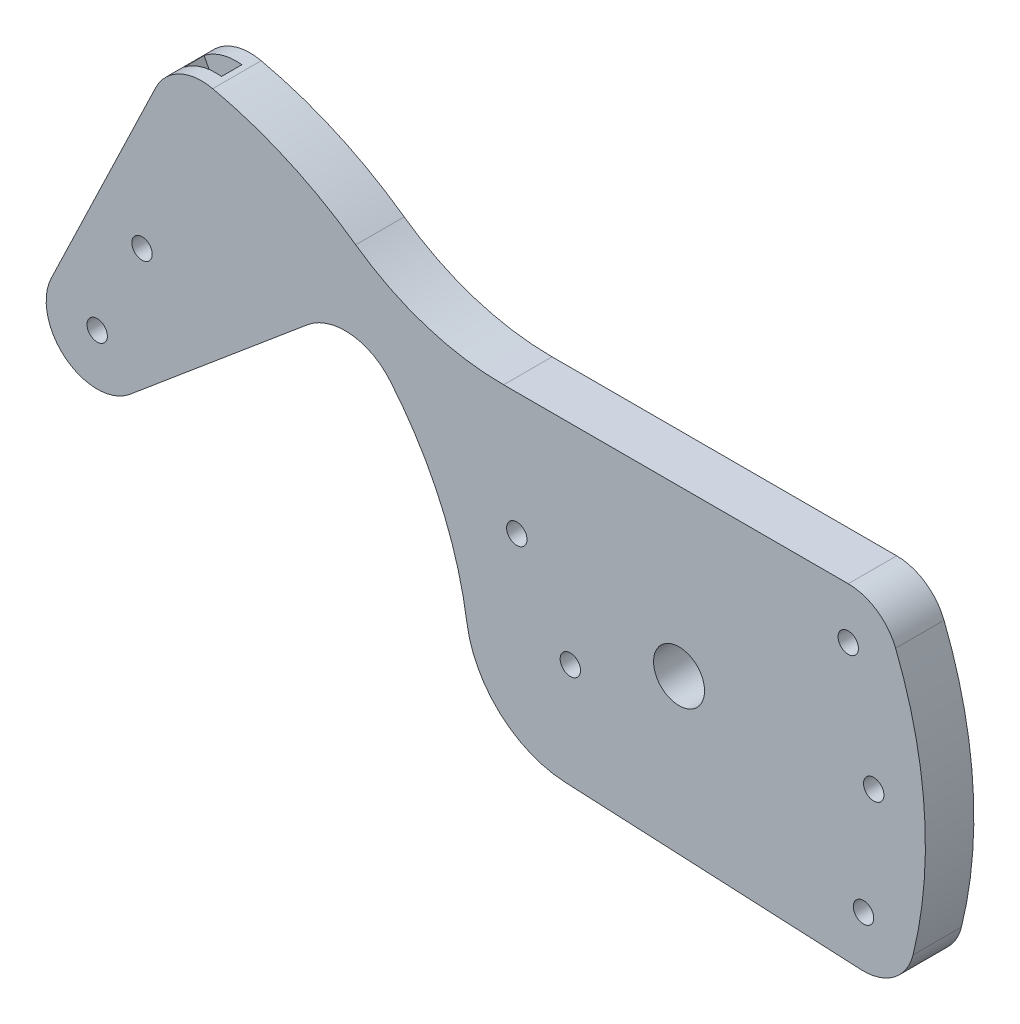
from build123d import *

# Parameters (mm, degrees)
SKETCH1_R           = 5
SKETCH1_R_2         = 2
BOSS_EXTRUDE1_DEPTH = 4.75
CUT_EXTRUDE1_DEPTH  = 2


with BuildPart() as part:
    # Sketch1 → Boss-Extrude1 (new, symmetric)
    with BuildSketch(Plane.XY):
        with BuildLine():
            Line((-22.308767332, -29.181670657), (35.698943118, -31.988315456))
            ThreePointArc((35.698943118, -31.988315456), (42.1516901, -30.02280497), (45.888257007, -24.406823948))
            ThreePointArc((45.888257007, -24.406823948), (48.128157677, 1.060560267), (42.475146865, 25.993435805))
            ThreePointArc((42.475146865, 25.993435805), (38.797626972, 30.574489653), (33.182217728, 32.3))
            Line((33.182217728, 32.3), (-34.397529085, 32.3))
            ThreePointArc((-34.397529085, 32.3), (-49.622555092, 34.67439152), (-63.401574193, 41.572056677))
            ThreePointArc((-63.401574193, 41.572056677), (-76.799263642, 49.225759558), (-91.448521696, 54.071013816))
            ThreePointArc((-91.448521696, 54.071013816), (-97.990041102, 53.309279516), (-102.639296293, 48.644931604))
            Line((-102.639296293, 48.644931604), (-123.129936653, 6.033713582))
            ThreePointArc((-123.129936653, 6.033713582), (-120.252485213, -6.197177966), (-107.689906175, -5.960444431))
            Line((-107.689906175, -5.960444431), (-72.864818345, 23.261273923))
            ThreePointArc((-72.864818345, 23.261273923), (-64.470178387, 25.908093735), (-56.662687309, 21.843771132))
            ThreePointArc((-56.662687309, 21.843771132), (-46.805355693, 6.125218695), (-41.605017691, -11.684788659))
            ThreePointArc((-41.605017691, -11.684788659), (-35.091884298, -23.890622031), (-22.308767332, -29.181670657))
        make_face()
        Circle(SKETCH1_R, mode=Mode.SUBTRACT)
        with Locations((36.182217728, -22)):
            Circle(SKETCH1_R_2, mode=Mode.SUBTRACT)
        with Locations((-21.317782272, -8.7)):
            Circle(SKETCH1_R_2, mode=Mode.SUBTRACT)
        with Locations((38.182217728, -0.1)):
            Circle(SKETCH1_R_2, mode=Mode.SUBTRACT)
        with Locations((33.182217728, 22.3)):
            Circle(SKETCH1_R_2, mode=Mode.SUBTRACT)
        with Locations((-31.817782272, 8.3)):
            Circle(SKETCH1_R_2, mode=Mode.SUBTRACT)
        with Locations((-105.317782272, 20)):
            Circle(SKETCH1_R_2, mode=Mode.SUBTRACT)
        with Locations((-114.117782272, 1.7)):
            Circle(SKETCH1_R_2, mode=Mode.SUBTRACT)
    extrude(amount=BOSS_EXTRUDE1_DEPTH, both=True)

    # Sketch2 → Cut-Extrude1 (cut, symmetric)
    with BuildSketch(Plane.XY):
        with BuildLine():
            Line((-78.227129447, 18.761760655), (-91.668909505, 44.876871439))
            Line((-91.668909505, 44.876871439), (-92.486661389, 54.245970368))
            ThreePointArc((-92.486661389, 54.245970368), (-96.402275052, 53.918435936), (-99.889427329, 52.10761343))
            Line((-99.889427329, 52.10761343), (-95.58537432, 43.745564604))
            Line((-95.58537432, 43.745564604), (-92.369017313, 6.895307763))
            Line((-92.369017313, 6.895307763), (-78.227129447, 18.761760655))
        make_face()
    extrude(amount=CUT_EXTRUDE1_DEPTH, both=True, mode=Mode.SUBTRACT)


solid = part.part
